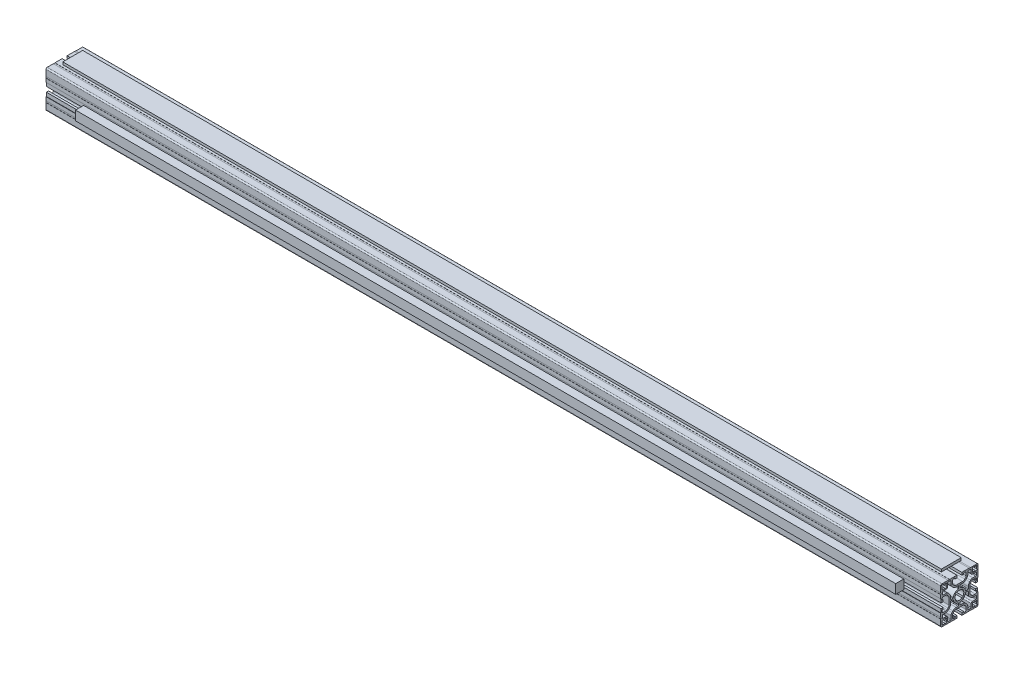
from build123d import *

# Parameters (mm, degrees)
BOSS_EXTRU_1_DEPTH = 1440
BOSS_EXTRU_2_START = 60
ESQUISSE3_W        = 13
ESQUISSE3_H        = 15
BOSS_EXTRU_2_DEPTH = 1320
BOSS_EXTRU_3_START = 13
ESQUISSE4_W        = 32
ESQUISSE4_H        = 4
BOSS_EXTRU_3_DEPTH = 1414


with BuildPart() as part:
    # Esquisse1 → Boss.-Extru.1 (new body)
    with BuildSketch(Plane(origin=(0, 0, 0), x_dir=(0, 0, -1), z_dir=(1, 0, 0))):
        with BuildLine():
            Line((-18.251881404, -59.1500001), (-19.869648357, -60.767767053))
            ThreePointArc((-19.869648357, -60.767767053), (-20.680706729, -61.309698931), (-21.63741531, -61.5000001))
            Line((-21.63741531, -61.5000001), (-25.481881404, -61.5000001))
            ThreePointArc((-25.481881404, -61.5000001), (-27.249648357, -60.767767053), (-27.981881404, -59.0000001))
            Line((-27.981881404, -59.0000001), (-27.981881404, -58.0000001))
            ThreePointArc((-27.981881404, -58.0000001), (-27.835434794, -57.646446709), (-27.481881404, -57.5000001))
            Line((-27.481881404, -57.5000001), (-25.981881404, -57.5000001))
            Line((-25.981881404, -57.5000001), (-25.981881404, -54.5050001))
            Line((-25.981881404, -54.5050001), (-29.481881404, -54.5050001))
            Line((-29.481881404, -54.5050001), (-29.481881404, -60.5050001))
            Line((-29.481881404, -60.5050001), (-29.981881404, -60.5050001))
            Line((-29.981881404, -60.5050001), (-29.981881404, -66.2500001))
            Line((-29.981881404, -66.2500001), (-29.781881404, -66.2500001))
            Line((-29.781881404, -66.2500001), (-29.781881404, -68.7500001))
            Line((-29.781881404, -68.7500001), (-29.981881404, -68.7500001))
            Line((-29.981881404, -68.7500001), (-29.981881404, -78.5000001))
            ThreePointArc((-29.981881404, -78.5000001), (-29.396094952, -79.914213596), (-27.981881437, -80.5))
            Line((-27.981881437, -80.5), (-18.23188142, -80.5))
            Line((-18.23188142, -80.5), (-18.23188142, -80.300000005))
            Line((-18.23188142, -80.300000005), (-15.73188142, -80.300000005))
            Line((-15.73188142, -80.300000005), (-15.73188142, -80.500000005))
            Line((-15.73188142, -80.500000005), (-3.98688142, -80.500000005))
            Line((-3.98688142, -80.500000005), (-3.98688142, -76.500000005))
            Line((-3.98688142, -76.500000005), (-6.98188142, -76.500000005))
            Line((-6.98188142, -76.500000005), (-6.98188142, -78.000000005))
            ThreePointArc((-6.98188142, -78.000000005), (-7.128328029, -78.353553396), (-7.48188142, -78.500000005))
            Line((-7.48188142, -78.500000005), (-8.48188142, -78.500000005))
            ThreePointArc((-8.48188142, -78.500000005), (-10.249648373, -77.767766958), (-10.98188142, -76.000000005))
            Line((-10.98188142, -76.000000005), (-10.98188142, -72.155533911))
            ThreePointArc((-10.98188142, -72.155533911), (-10.791580251, -71.19882533), (-10.249648373, -70.387766958))
            Line((-10.249648373, -70.387766958), (-8.63188142, -68.770000005))
            ThreePointArc((-8.63188142, -68.770000005), (-7.008495778, -67.681928693), (-5.09188142, -67.300000005))
            Line((-5.09188142, -67.300000005), (5.100034289, -67.300000005))
            ThreePointArc((5.100034289, -67.300000005), (7.016648647, -67.681928693), (8.640034289, -68.770000005))
            Line((8.640034289, -68.770000005), (10.257801242, -70.387766958))
            ThreePointArc((10.257801242, -70.387766958), (10.79973312, -71.19882533), (10.990034289, -72.155533911))
            Line((10.990034289, -72.155533911), (10.990034289, -76.000000005))
            ThreePointArc((10.990034289, -76.000000005), (10.257801242, -77.767766958), (8.490034289, -78.500000005))
            Line((8.490034289, -78.500000005), (7.490034289, -78.500000005))
            ThreePointArc((7.490034289, -78.500000005), (7.136480898, -78.353553396), (6.990034289, -78.000000005))
            Line((6.990034289, -78.000000005), (6.990034289, -76.500000005))
            Line((6.990034289, -76.500000005), (3.995034289, -76.500000005))
            Line((3.995034289, -76.500000005), (3.995034289, -80.500000005))
            Line((3.995034289, -80.500000005), (15.740034289, -80.500000005))
            Line((15.740034289, -80.500000005), (15.740034289, -80.300000005))
            Line((15.740034289, -80.300000005), (18.240034289, -80.300000005))
            Line((18.240034289, -80.300000005), (18.240034289, -80.500000005))
            Line((18.240034289, -80.500000005), (27.990034289, -80.500000005))
            ThreePointArc((27.990034289, -80.500000005), (28.755401132, -80.347759079), (29.404247818, -79.914213601))
            ThreePointArc((29.404247818, -79.914213601), (29.831837547, -79.268193521), (29.981881404, -78.50815289))
            Line((29.981881404, -78.50815289), (29.981881404, -68.75815289))
            Line((29.981881404, -68.75815289), (29.781881404, -68.75815289))
            Line((29.781881404, -68.75815289), (29.781881404, -66.25815289))
            Line((29.781881404, -66.25815289), (29.981881404, -66.25815289))
            Line((29.981881404, -66.25815289), (29.981881404, -60.523084363))
            Line((29.981881404, -60.523084363), (29.481881404, -60.523084363))
            Line((29.481881404, -60.523084363), (29.481881404, -54.51315289))
            Line((29.481881404, -54.51315289), (25.981881404, -54.51315289))
            Line((25.981881404, -54.51315289), (25.981881404, -57.50815289))
            Line((25.981881404, -57.50815289), (27.481881404, -57.50815289))
            ThreePointArc((27.481881404, -57.50815289), (27.835434794, -57.6545995), (27.981881404, -58.00815289))
            Line((27.981881404, -58.00815289), (27.981881404, -59.00815289))
            ThreePointArc((27.981881404, -59.00815289), (27.249648357, -60.775919843), (25.481881404, -61.50815289))
            Line((25.481881404, -61.50815289), (21.63741531, -61.50815289))
            ThreePointArc((21.63741531, -61.50815289), (20.680706729, -61.317851721), (19.869648357, -60.775919843))
            Line((19.869648357, -60.775919843), (18.251881404, -59.15815289))
            ThreePointArc((18.251881404, -59.15815289), (17.163810092, -57.534767248), (16.781881404, -55.61815289))
            Line((16.781881404, -55.61815289), (16.781881404, -45.426237182))
            ThreePointArc((16.781881404, -45.426237182), (17.163810092, -43.509622823), (18.251881404, -41.886237182))
            Line((18.251881404, -41.886237182), (19.869648357, -40.268470229))
            ThreePointArc((19.869648357, -40.268470229), (20.680706729, -39.72653835), (21.63741531, -39.536237182))
            Line((21.63741531, -39.536237182), (25.481881404, -39.536237182))
            ThreePointArc((25.481881404, -39.536237182), (27.249648357, -40.268470229), (27.981881404, -42.036237182))
            Line((27.981881404, -42.036237182), (27.981881404, -43.036237182))
            ThreePointArc((27.981881404, -43.036237182), (27.835434794, -43.389790572), (27.481881404, -43.536237182))
            Line((27.481881404, -43.536237182), (25.981881404, -43.536237182))
            Line((25.981881404, -43.536237182), (25.981881404, -46.531237182))
            Line((25.981881404, -46.531237182), (29.481881404, -46.531237182))
            Line((29.481881404, -46.531237182), (29.481881404, -40.523084363))
            Line((29.481881404, -40.523084363), (29.981881404, -40.523084363))
            Line((29.981881404, -40.523084363), (29.981881404, -34.786237182))
            Line((29.981881404, -34.786237182), (29.781881404, -34.786237182))
            Line((29.781881404, -34.786237182), (29.781881404, -32.286237182))
            Line((29.781881404, -32.286237182), (29.981881404, -32.286237182))
            Line((29.981881404, -32.286237182), (29.981881404, -22.536237182))
            ThreePointArc((29.981881404, -22.536237182), (29.729326777, -21.563388519), (29.035446795, -20.836237277))
            Line((29.035446795, -20.836237277), (17.981881353, -20.836237277))
            Line((17.981881353, -20.836237277), (17.981881353, -20.736237277))
            Line((17.981881353, -20.736237277), (15.73188142, -20.736237277))
            Line((15.73188142, -20.736237277), (15.73188142, -20.536237277))
            Line((15.73188142, -20.536237277), (3.98688142, -20.536237277))
            Line((3.98688142, -20.536237277), (3.98688142, -24.536237277))
            Line((3.98688142, -24.536237277), (6.98188142, -24.536237277))
            Line((6.98188142, -24.536237277), (6.98188142, -23.036237277))
            ThreePointArc((6.98188142, -23.036237277), (7.128328029, -22.682683886), (7.48188142, -22.536237277))
            Line((7.48188142, -22.536237277), (8.48188142, -22.536237277))
            ThreePointArc((8.48188142, -22.536237277), (10.249648373, -23.268470324), (10.98188142, -25.036237277))
            Line((10.98188142, -25.036237277), (10.98188142, -28.880703371))
            ThreePointArc((10.98188142, -28.880703371), (10.791580251, -29.837411952), (10.249648373, -30.648470324))
            Line((10.249648373, -30.648470324), (8.63188142, -32.266237277))
            ThreePointArc((8.63188142, -32.266237277), (7.008495778, -33.354308588), (5.09188142, -33.736237277))
            Line((5.09188142, -33.736237277), (-5.100034289, -33.736237277))
            ThreePointArc((-5.100034289, -33.736237277), (-7.016648647, -33.354308588), (-8.640034289, -32.266237277))
            Line((-8.640034289, -32.266237277), (-10.257801242, -30.648470324))
            ThreePointArc((-10.257801242, -30.648470324), (-10.79973312, -29.837411952), (-10.990034289, -28.880703371))
            Line((-10.990034289, -28.880703371), (-10.990034289, -25.036237277))
            ThreePointArc((-10.990034289, -25.036237277), (-10.257801242, -23.268470324), (-8.490034289, -22.536237277))
            Line((-8.490034289, -22.536237277), (-7.490034289, -22.536237277))
            ThreePointArc((-7.490034289, -22.536237277), (-7.136480898, -22.682683886), (-6.990034289, -23.036237277))
            Line((-6.990034289, -23.036237277), (-6.990034289, -24.536237277))
            Line((-6.990034289, -24.536237277), (-3.995034289, -24.536237277))
            Line((-3.995034289, -24.536237277), (-3.995034289, -20.536237277))
            Line((-3.995034289, -20.536237277), (-15.740034289, -20.536237277))
            Line((-15.740034289, -20.536237277), (-15.740034289, -20.736237277))
            Line((-15.740034289, -20.736237277), (-18.23188142, -20.736237277))
            Line((-18.23188142, -20.736237277), (-18.23188142, -20.546168783))
            Line((-18.23188142, -20.546168783), (-27.981881437, -20.546168783))
            ThreePointArc((-27.981881437, -20.546168783), (-29.396094976, -21.131955211), (-29.981881404, -22.54616875))
            Line((-29.981881404, -22.54616875), (-29.981881404, -32.278084391))
            Line((-29.981881404, -32.278084391), (-29.781881404, -32.278084391))
            Line((-29.781881404, -32.278084391), (-29.781881404, -34.778084391))
            Line((-29.781881404, -34.778084391), (-29.981881404, -34.778084391))
            Line((-29.981881404, -34.778084391), (-29.981881404, -40.5050001))
            Line((-29.981881404, -40.5050001), (-29.481881404, -40.5050001))
            Line((-29.481881404, -40.5050001), (-29.481881404, -46.523084391))
            Line((-29.481881404, -46.523084391), (-25.981881404, -46.523084391))
            Line((-25.981881404, -46.523084391), (-25.981881404, -43.528084391))
            Line((-25.981881404, -43.528084391), (-27.481881404, -43.528084391))
            ThreePointArc((-27.481881404, -43.528084391), (-27.835434794, -43.381637782), (-27.981881404, -43.028084391))
            Line((-27.981881404, -43.028084391), (-27.981881404, -42.028084391))
            ThreePointArc((-27.981881404, -42.028084391), (-27.249648357, -40.260317438), (-25.481881404, -39.528084391))
            Line((-25.481881404, -39.528084391), (-21.63741531, -39.528084391))
            ThreePointArc((-21.63741531, -39.528084391), (-20.680706729, -39.71838556), (-19.869648357, -40.260317438))
            Line((-19.869648357, -40.260317438), (-18.251881404, -41.878084391))
            ThreePointArc((-18.251881404, -41.878084391), (-17.163810092, -43.501470033), (-16.781881404, -45.418084391))
            Line((-16.781881404, -45.418084391), (-16.781881404, -55.6100001))
            ThreePointArc((-16.781881404, -55.6100001), (-17.163810092, -57.526614458), (-18.251881404, -59.1500001))
        make_face()
        with BuildLine():
            Line((5.105923565, -36.214042246), (1.995923565, -36.214042246))
            ThreePointArc((1.995923565, -36.214042246), (1.288816784, -36.506935465), (0.995923565, -37.214042246))
            Line((0.995923565, -37.214042246), (0.995923565, -39.704042246))
            ThreePointArc((0.995923565, -39.704042246), (1.227215674, -40.34364226), (1.814099921, -40.687373402))
            ThreePointArc((1.814099921, -40.687373402), (7.068115974, -43.444097911), (9.829235125, -48.695805799))
            ThreePointArc((9.829235125, -48.695805799), (10.175605714, -49.282155413), (10.815923565, -49.514042246))
            Line((10.815923565, -49.514042246), (13.295923565, -49.514042246))
            ThreePointArc((13.295923565, -49.514042246), (14.003030346, -49.221149027), (14.295923565, -48.514042246))
            Line((14.295923565, -48.514042246), (14.295923565, -45.414042246))
            ThreePointArc((14.295923565, -45.414042246), (14.868270922, -42.540429098), (16.495923565, -40.104042246))
            Line((16.495923565, -40.104042246), (18.121457471, -38.47850834))
            ThreePointArc((18.121457471, -38.47850834), (19.743574215, -37.394644583), (21.656991377, -37.014042246))
            Line((21.656991377, -37.014042246), (26.495923565, -37.014042246))
            ThreePointArc((26.495923565, -37.014042246), (27.203030346, -36.721149027), (27.495923565, -36.014042246))
            Line((27.495923565, -36.014042246), (27.495923565, -32.514042246))
            ThreePointArc((27.495923565, -32.514042246), (27.203030346, -31.806935465), (26.495923565, -31.514042246))
            Line((26.495923565, -31.514042246), (20.995923565, -31.514042246))
            ThreePointArc((20.995923565, -31.514042246), (19.581710003, -30.928255808), (18.995923565, -29.514042246))
            Line((18.995923565, -29.514042246), (18.995923565, -24.014042246))
            ThreePointArc((18.995923565, -24.014042246), (18.703030346, -23.306935465), (17.995923565, -23.014042246))
            Line((17.995923565, -23.014042246), (14.495923565, -23.014042246))
            ThreePointArc((14.495923565, -23.014042246), (13.788816784, -23.306935465), (13.495923565, -24.014042246))
            Line((13.495923565, -24.014042246), (13.495923565, -28.872078671))
            ThreePointArc((13.495923565, -28.872078671), (13.1126217, -30.79200011), (12.021484233, -32.417557761))
            Line((12.021484233, -32.417557761), (10.405923565, -34.024042246))
            ThreePointArc((10.405923565, -34.024042246), (7.973004403, -35.644397699), (5.105923565, -36.214042246))
        make_face(mode=Mode.SUBTRACT)
        with BuildLine():
            Line((-1.004076435, -39.704042246), (-1.004076435, -37.214042246))
            ThreePointArc((-1.004076435, -37.214042246), (-1.296969654, -36.506935465), (-2.004076435, -36.214042246))
            Line((-2.004076435, -36.214042246), (-5.114076435, -36.214042246))
            ThreePointArc((-5.114076435, -36.214042246), (-7.981157273, -35.644397699), (-10.414076435, -34.024042246))
            Line((-10.414076435, -34.024042246), (-12.029637103, -32.417557761))
            ThreePointArc((-12.029637103, -32.417557761), (-13.12077457, -30.79200011), (-13.504076435, -28.872078671))
            Line((-13.504076435, -28.872078671), (-13.504076435, -24.014042246))
            ThreePointArc((-13.504076435, -24.014042246), (-13.796969654, -23.306935465), (-14.504076435, -23.014042246))
            Line((-14.504076435, -23.014042246), (-18.004076435, -23.014042246))
            ThreePointArc((-18.004076435, -23.014042246), (-18.711183216, -23.306935465), (-19.004076435, -24.014042246))
            Line((-19.004076435, -24.014042246), (-19.004076435, -29.514042246))
            ThreePointArc((-19.004076435, -29.514042246), (-19.589862872, -30.928255808), (-21.004076435, -31.514042246))
            Line((-21.004076435, -31.514042246), (-26.504076435, -31.514042246))
            ThreePointArc((-26.504076435, -31.514042246), (-27.211183216, -31.806935465), (-27.504076435, -32.514042246))
            Line((-27.504076435, -32.514042246), (-27.504076435, -36.014042246))
            ThreePointArc((-27.504076435, -36.014042246), (-27.211183216, -36.721149027), (-26.504076435, -37.014042246))
            Line((-26.504076435, -37.014042246), (-21.665144247, -37.014042246))
            ThreePointArc((-21.665144247, -37.014042246), (-19.751727085, -37.394644583), (-18.129610341, -38.47850834))
            Line((-18.129610341, -38.47850834), (-16.504076435, -40.104042246))
            ThreePointArc((-16.504076435, -40.104042246), (-14.876423791, -42.540429098), (-14.304076435, -45.414042246))
            Line((-14.304076435, -45.414042246), (-14.304076435, -48.514042246))
            ThreePointArc((-14.304076435, -48.514042246), (-14.011183216, -49.221149027), (-13.304076435, -49.514042246))
            Line((-13.304076435, -49.514042246), (-10.824076435, -49.514042246))
            ThreePointArc((-10.824076435, -49.514042246), (-10.183758583, -49.282155412), (-9.837387994, -48.695805799))
            ThreePointArc((-9.837387994, -48.695805799), (-7.076268843, -43.444097911), (-1.82225279, -40.687373402))
            ThreePointArc((-1.82225279, -40.687373402), (-1.235368543, -40.34364226), (-1.004076435, -39.704042246))
        make_face(mode=Mode.SUBTRACT)
        with BuildLine():
            Line((-27.504076435, -65.014042246), (-27.504076435, -68.514042246))
            ThreePointArc((-27.504076435, -68.514042246), (-27.211183216, -69.221149027), (-26.504076435, -69.514042246))
            Line((-26.504076435, -69.514042246), (-21.004076435, -69.514042246))
            ThreePointArc((-21.004076435, -69.514042246), (-19.589862872, -70.099828683), (-19.004076435, -71.514042246))
            Line((-19.004076435, -71.514042246), (-19.004076435, -77.014042246))
            ThreePointArc((-19.004076435, -77.014042246), (-18.711183216, -77.721149027), (-18.004076435, -78.014042246))
            Line((-18.004076435, -78.014042246), (-14.504076435, -78.014042246))
            ThreePointArc((-14.504076435, -78.014042246), (-13.796969654, -77.721149027), (-13.504076435, -77.014042246))
            Line((-13.504076435, -77.014042246), (-13.504076435, -72.15600582))
            ThreePointArc((-13.504076435, -72.15600582), (-13.12077457, -70.236084381), (-12.029637103, -68.61052673))
            Line((-12.029637103, -68.61052673), (-10.414076435, -67.004042246))
            ThreePointArc((-10.414076435, -67.004042246), (-7.981157273, -65.383686793), (-5.114076435, -64.814042246))
            Line((-5.114076435, -64.814042246), (-2.004076435, -64.814042246))
            ThreePointArc((-2.004076435, -64.814042246), (-1.296969654, -64.521149027), (-1.004076435, -63.814042246))
            Line((-1.004076435, -63.814042246), (-1.004076435, -61.324042246))
            ThreePointArc((-1.004076435, -61.324042246), (-1.235368543, -60.684442232), (-1.82225279, -60.34071109))
            ThreePointArc((-1.82225279, -60.34071109), (-7.076268843, -57.58398658), (-9.837387994, -52.332278692))
            ThreePointArc((-9.837387994, -52.332278692), (-10.183758583, -51.745929079), (-10.824076435, -51.514042246))
            Line((-10.824076435, -51.514042246), (-13.304076435, -51.514042246))
            ThreePointArc((-13.304076435, -51.514042246), (-14.011183216, -51.806935465), (-14.304076435, -52.514042246))
            Line((-14.304076435, -52.514042246), (-14.304076435, -55.614042246))
            ThreePointArc((-14.304076435, -55.614042246), (-14.876423791, -58.487655394), (-16.504076435, -60.924042246))
            Line((-16.504076435, -60.924042246), (-18.129610341, -62.549576152))
            ThreePointArc((-18.129610341, -62.549576152), (-19.751727085, -63.633439908), (-21.665144247, -64.014042246))
            Line((-21.665144247, -64.014042246), (-26.504076435, -64.014042246))
            ThreePointArc((-26.504076435, -64.014042246), (-27.211183216, -64.306935465), (-27.504076435, -65.014042246))
        make_face(mode=Mode.SUBTRACT)
        with BuildLine():
            Line((27.495923565, -68.514042246), (27.495923565, -65.014042246))
            ThreePointArc((27.495923565, -65.014042246), (27.203030346, -64.306935465), (26.495923565, -64.014042246))
            Line((26.495923565, -64.014042246), (21.656991377, -64.014042246))
            ThreePointArc((21.656991377, -64.014042246), (19.743574215, -63.633439908), (18.121457471, -62.549576152))
            Line((18.121457471, -62.549576152), (16.495923565, -60.924042246))
            ThreePointArc((16.495923565, -60.924042246), (14.868270922, -58.487655394), (14.295923565, -55.614042246))
            Line((14.295923565, -55.614042246), (14.295923565, -52.514042246))
            ThreePointArc((14.295923565, -52.514042246), (14.003030346, -51.806935465), (13.295923565, -51.514042246))
            Line((13.295923565, -51.514042246), (10.815923565, -51.514042246))
            ThreePointArc((10.815923565, -51.514042246), (10.175605714, -51.745929079), (9.829235125, -52.332278692))
            ThreePointArc((9.829235125, -52.332278692), (7.068115974, -57.58398658), (1.814099921, -60.34071109))
            ThreePointArc((1.814099921, -60.34071109), (1.227215674, -60.684442232), (0.995923565, -61.324042246))
            Line((0.995923565, -61.324042246), (0.995923565, -63.814042246))
            ThreePointArc((0.995923565, -63.814042246), (1.288816784, -64.521149027), (1.995923565, -64.814042246))
            Line((1.995923565, -64.814042246), (5.105923565, -64.814042246))
            ThreePointArc((5.105923565, -64.814042246), (7.973004403, -65.383686793), (10.405923565, -67.004042246))
            Line((10.405923565, -67.004042246), (12.021484233, -68.61052673))
            ThreePointArc((12.021484233, -68.61052673), (13.1126217, -70.236084381), (13.495923565, -72.15600582))
            Line((13.495923565, -72.15600582), (13.495923565, -77.014042246))
            ThreePointArc((13.495923565, -77.014042246), (13.788816784, -77.721149027), (14.495923565, -78.014042246))
            Line((14.495923565, -78.014042246), (17.995923565, -78.014042246))
            ThreePointArc((17.995923565, -78.014042246), (18.703030346, -77.721149027), (18.995923565, -77.014042246))
            Line((18.995923565, -77.014042246), (18.995923565, -71.514042246))
            ThreePointArc((18.995923565, -71.514042246), (19.581710003, -70.099828683), (20.995923565, -69.514042246))
            Line((20.995923565, -69.514042246), (26.495923565, -69.514042246))
            ThreePointArc((26.495923565, -69.514042246), (27.203030346, -69.221149027), (27.495923565, -68.514042246))
        make_face(mode=Mode.SUBTRACT)
        with BuildLine():
            ThreePointArc((22.912279732, -22.7334063), (21.207877033, -22.725995713), (21.215287619, -24.430398413))
            ThreePointArc((21.215287619, -24.430398413), (21.298411373, -24.581800314), (21.284281458, -24.753941068))
            ThreePointArc((21.284281458, -24.753941068), (21.045923565, -26.014042246), (21.284281458, -27.274143423))
            ThreePointArc((21.284281458, -27.274143423), (21.298411373, -27.446284178), (21.215287619, -27.597686079))
            ThreePointArc((21.215287619, -27.597686079), (21.207877033, -29.302088778), (22.912279732, -29.294678192))
            ThreePointArc((22.912279732, -29.294678192), (23.063681633, -29.211554438), (23.235822388, -29.225684353))
            ThreePointArc((23.235822388, -29.225684353), (24.495923565, -29.464042246), (25.756024743, -29.225684353))
            ThreePointArc((25.756024743, -29.225684353), (25.928165497, -29.211554438), (26.079567398, -29.294678192))
            ThreePointArc((26.079567398, -29.294678192), (27.783970098, -29.302088778), (27.776559511, -27.597686079))
            ThreePointArc((27.776559511, -27.597686079), (27.693435758, -27.446284178), (27.707565672, -27.274143423))
            ThreePointArc((27.707565672, -27.274143423), (27.945923565, -26.014042246), (27.707565672, -24.753941068))
            ThreePointArc((27.707565672, -24.753941068), (27.693435758, -24.581800314), (27.776559511, -24.430398413))
            ThreePointArc((27.776559511, -24.430398413), (27.783970098, -22.725995713), (26.079567398, -22.7334063))
            ThreePointArc((26.079567398, -22.7334063), (25.928165497, -22.816530053), (25.756024743, -22.802400139))
            ThreePointArc((25.756024743, -22.802400139), (24.495923565, -22.564042246), (23.235822388, -22.802400139))
            ThreePointArc((23.235822388, -22.802400139), (23.063681633, -22.816530053), (22.912279732, -22.7334063))
        make_face(mode=Mode.SUBTRACT)
        with BuildLine():
            ThreePointArc((-4.259305053, -44.675898237), (-5.565250792, -44.769660923), (-5.659013478, -46.075606662))
            ThreePointArc((-5.659013478, -46.075606662), (-5.599317243, -46.250183538), (-5.653073861, -46.426679862))
            ThreePointArc((-5.653073861, -46.426679862), (-6.908396543, -50.426515172), (-5.653073861, -54.426350482))
            ThreePointArc((-5.653073861, -54.426350482), (-5.599317243, -54.602846806), (-5.659013478, -54.777423683))
            ThreePointArc((-5.659013478, -54.777423683), (-5.565250792, -56.083369422), (-4.259305053, -56.177132107))
            ThreePointArc((-4.259305053, -56.177132107), (-4.084728176, -56.117435873), (-3.908231852, -56.171192491))
            ThreePointArc((-3.908231852, -56.171192491), (0.091603457, -57.426515172), (4.091438767, -56.171192491))
            ThreePointArc((4.091438767, -56.171192491), (4.267935091, -56.117435873), (4.442511968, -56.177132107))
            ThreePointArc((4.442511968, -56.177132107), (5.748457707, -56.083369422), (5.842220392, -54.777423683))
            ThreePointArc((5.842220392, -54.777423683), (5.782524158, -54.602846806), (5.836280776, -54.426350482))
            ThreePointArc((5.836280776, -54.426350482), (7.091603457, -50.426515172), (5.836280776, -46.426679862))
            ThreePointArc((5.836280776, -46.426679862), (5.782524158, -46.250183538), (5.842220392, -46.075606662))
            ThreePointArc((5.842220392, -46.075606662), (5.748457707, -44.769660923), (4.442511968, -44.675898237))
            ThreePointArc((4.442511968, -44.675898237), (4.267935091, -44.735594471), (4.091438767, -44.681837854))
            ThreePointArc((4.091438767, -44.681837854), (0.091603457, -43.426515172), (-3.908231852, -44.681837854))
            ThreePointArc((-3.908231852, -44.681837854), (-4.084728176, -44.735594471), (-4.259305053, -44.675898237))
        make_face(mode=Mode.SUBTRACT)
        with BuildLine():
            ThreePointArc((-26.087720268, -71.7334063), (-27.792122967, -71.725995713), (-27.784712381, -73.430398413))
            ThreePointArc((-27.784712381, -73.430398413), (-27.701588627, -73.581800314), (-27.715718542, -73.753941068))
            ThreePointArc((-27.715718542, -73.753941068), (-27.954076435, -75.014042246), (-27.715718542, -76.274143423))
            ThreePointArc((-27.715718542, -76.274143423), (-27.701588627, -76.446284178), (-27.784712381, -76.597686079))
            ThreePointArc((-27.784712381, -76.597686079), (-27.792122967, -78.302088778), (-26.087720268, -78.294678192))
            ThreePointArc((-26.087720268, -78.294678192), (-25.936318367, -78.211554438), (-25.764177612, -78.225684353))
            ThreePointArc((-25.764177612, -78.225684353), (-24.504076435, -78.464042246), (-23.243975257, -78.225684353))
            ThreePointArc((-23.243975257, -78.225684353), (-23.071834503, -78.211554438), (-22.920432602, -78.294678192))
            ThreePointArc((-22.920432602, -78.294678192), (-21.216029902, -78.302088778), (-21.223440489, -76.597686079))
            ThreePointArc((-21.223440489, -76.597686079), (-21.306564242, -76.446284178), (-21.292434328, -76.274143423))
            ThreePointArc((-21.292434328, -76.274143423), (-21.054076435, -75.014042246), (-21.292434328, -73.753941068))
            ThreePointArc((-21.292434328, -73.753941068), (-21.306564242, -73.581800314), (-21.223440489, -73.430398413))
            ThreePointArc((-21.223440489, -73.430398413), (-21.216029902, -71.725995713), (-22.920432602, -71.7334063))
            ThreePointArc((-22.920432602, -71.7334063), (-23.071834503, -71.816530053), (-23.243975257, -71.802400139))
            ThreePointArc((-23.243975257, -71.802400139), (-24.504076435, -71.564042246), (-25.764177612, -71.802400139))
            ThreePointArc((-25.764177612, -71.802400139), (-25.936318367, -71.816530053), (-26.087720268, -71.7334063))
        make_face(mode=Mode.SUBTRACT)
        with BuildLine():
            ThreePointArc((27.776559511, -73.430398413), (27.783970098, -71.725995713), (26.079567398, -71.7334063))
            ThreePointArc((26.079567398, -71.7334063), (25.928165497, -71.816530053), (25.756024743, -71.802400139))
            ThreePointArc((25.756024743, -71.802400139), (24.495923565, -71.564042246), (23.235822388, -71.802400139))
            ThreePointArc((23.235822388, -71.802400139), (23.063681633, -71.816530053), (22.912279732, -71.7334063))
            ThreePointArc((22.912279732, -71.7334063), (21.207877033, -71.725995713), (21.215287619, -73.430398413))
            ThreePointArc((21.215287619, -73.430398413), (21.298411373, -73.581800314), (21.284281458, -73.753941068))
            ThreePointArc((21.284281458, -73.753941068), (21.045923565, -75.014042246), (21.284281458, -76.274143423))
            ThreePointArc((21.284281458, -76.274143423), (21.298411373, -76.446284178), (21.215287619, -76.597686079))
            ThreePointArc((21.215287619, -76.597686079), (21.207877033, -78.302088778), (22.912279732, -78.294678192))
            ThreePointArc((22.912279732, -78.294678192), (23.063681633, -78.211554438), (23.235822388, -78.225684353))
            ThreePointArc((23.235822388, -78.225684353), (24.495923565, -78.464042246), (25.756024743, -78.225684353))
            ThreePointArc((25.756024743, -78.225684353), (25.928165497, -78.211554438), (26.079567398, -78.294678192))
            ThreePointArc((26.079567398, -78.294678192), (27.783970098, -78.302088778), (27.776559511, -76.597686079))
            ThreePointArc((27.776559511, -76.597686079), (27.693435758, -76.446284178), (27.707565672, -76.274143423))
            ThreePointArc((27.707565672, -76.274143423), (27.945923565, -75.014042246), (27.707565672, -73.753941068))
            ThreePointArc((27.707565672, -73.753941068), (27.693435758, -73.581800314), (27.776559511, -73.430398413))
        make_face(mode=Mode.SUBTRACT)
        with BuildLine():
            ThreePointArc((-26.087720268, -22.7334063), (-27.792122967, -22.725995713), (-27.784712381, -24.430398413))
            ThreePointArc((-27.784712381, -24.430398413), (-27.701588627, -24.581800314), (-27.715718542, -24.753941068))
            ThreePointArc((-27.715718542, -24.753941068), (-27.954076435, -26.014042246), (-27.715718542, -27.274143423))
            ThreePointArc((-27.715718542, -27.274143423), (-27.701588627, -27.446284178), (-27.784712381, -27.597686079))
            ThreePointArc((-27.784712381, -27.597686079), (-27.792122967, -29.302088778), (-26.087720268, -29.294678192))
            ThreePointArc((-26.087720268, -29.294678192), (-25.936318367, -29.211554438), (-25.764177612, -29.225684353))
            ThreePointArc((-25.764177612, -29.225684353), (-24.504076435, -29.464042246), (-23.243975257, -29.225684353))
            ThreePointArc((-23.243975257, -29.225684353), (-23.071834503, -29.211554438), (-22.920432602, -29.294678192))
            ThreePointArc((-22.920432602, -29.294678192), (-21.216029902, -29.302088778), (-21.223440489, -27.597686079))
            ThreePointArc((-21.223440489, -27.597686079), (-21.306564242, -27.446284178), (-21.292434328, -27.274143423))
            ThreePointArc((-21.292434328, -27.274143423), (-21.054076435, -26.014042246), (-21.292434328, -24.753941068))
            ThreePointArc((-21.292434328, -24.753941068), (-21.306564242, -24.581800314), (-21.223440489, -24.430398413))
            ThreePointArc((-21.223440489, -24.430398413), (-21.216029902, -22.725995713), (-22.920432602, -22.7334063))
            ThreePointArc((-22.920432602, -22.7334063), (-23.071834503, -22.816530053), (-23.243975257, -22.802400139))
            ThreePointArc((-23.243975257, -22.802400139), (-24.504076435, -22.564042246), (-25.764177612, -22.802400139))
            ThreePointArc((-25.764177612, -22.802400139), (-25.936318367, -22.816530053), (-26.087720268, -22.7334063))
        make_face(mode=Mode.SUBTRACT)
    extrude(amount=BOSS_EXTRU_1_DEPTH)

    # Esquisse3 → Boss.-Extru.2 (add)
    with BuildSketch(Plane(origin=(0, 0, 0), x_dir=(0, 0, -1), z_dir=(1, 0, 0)).offset(BOSS_EXTRU_2_START)):
        with Locations((-35.981881404, -50.514042246)):
            Rectangle(ESQUISSE3_W, ESQUISSE3_H)
        with Locations((35.981881404, -50.522195036)):
            Rectangle(ESQUISSE3_W, ESQUISSE3_H)
    extrude(amount=BOSS_EXTRU_2_DEPTH)


with BuildPart() as body_2:
    # Esquisse4 → Boss.-Extru.3 (new body)
    with BuildSketch(Plane(origin=(0, 0, 0), x_dir=(0, 0, -1), z_dir=(1, 0, 0)).offset(BOSS_EXTRU_3_START)):
        with Locations((-0.004076435, -14.536237277)):
            Rectangle(ESQUISSE4_W, ESQUISSE4_H)
    extrude(amount=BOSS_EXTRU_3_DEPTH)


solid = Compound([part.part, body_2.part])
